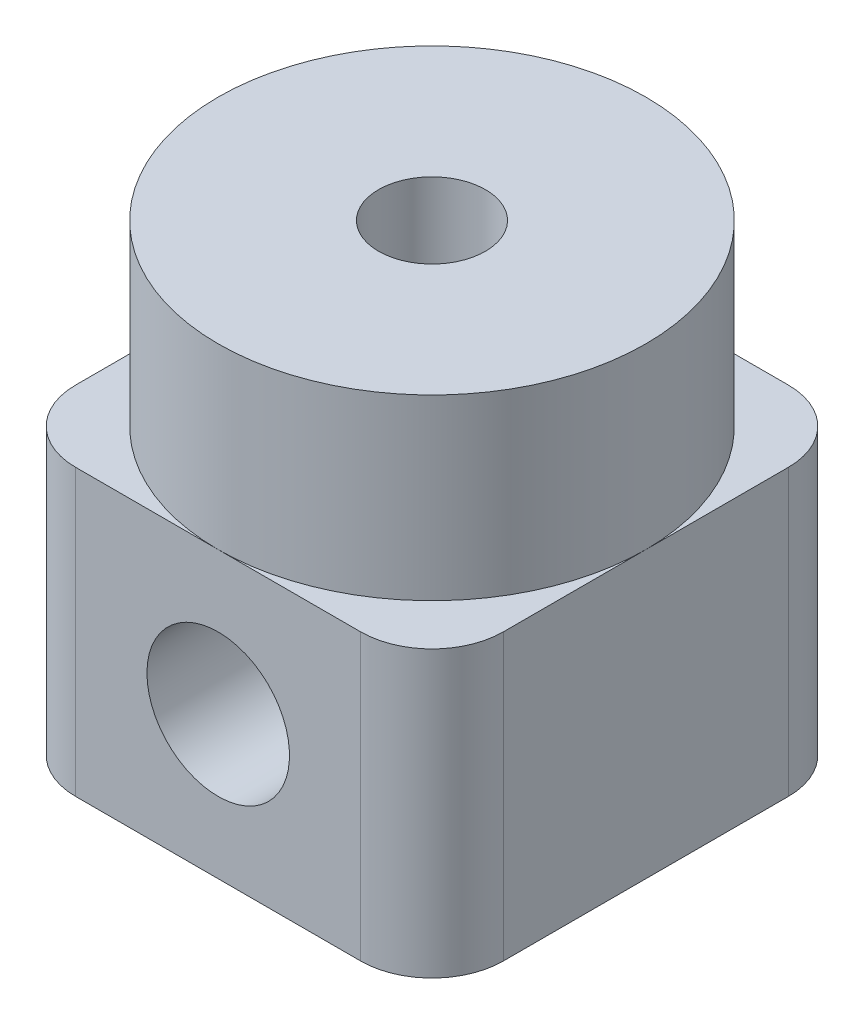
from build123d import *

# Parameters (mm, degrees)
SKETCH_1_R          = 6
EXTRUDE_1_DEPTH     = 5
SKETCH_2_W          = 12
SKETCH_2_H          = 12
EXTRUDE_2_DEPTH     = 8
FILLET_1_R          = 2
SKETCH_3_R          = 1.5
CUT_EXTRUDE_1_DEPTH = 5
SKETCH_4_R          = 2
CUT_EXTRUDE_2_DEPTH = 16.620499352


with BuildPart() as part:
    # 草图1 → 凸台-拉伸1 (new body)
    with BuildSketch(Plane(origin=(0, 0, 0), x_dir=(1, 0, 0), z_dir=(0, 1, 0))):
        with Locations(Location((0, 0, 0), (0, 0, 270))):
            Circle(SKETCH_1_R)
    extrude(amount=EXTRUDE_1_DEPTH)

    # 草图2 → 凸台-拉伸2 (add)
    with BuildSketch(Plane.XZ):
        Rectangle(SKETCH_2_W, SKETCH_2_H)
    extrude(amount=EXTRUDE_2_DEPTH)

    # 圆角1
    fillet_1_edges = [part.edges().sort_by_distance(p)[0] for p in [
        (-6, -4, 6),
        (-6, -4, -6),
        (6, -4, -6),
        (6, -4, 6),
    ]]
    fillet(fillet_1_edges, radius=FILLET_1_R)

    # 草图3 → 切除-拉伸1 (cut)
    with BuildSketch(Plane(origin=(0, 5, 0), x_dir=(1, 0, 0), z_dir=(0, 1, 0))):
        with Locations(Location((0, 0, 0), (0, 0, 270))):
            Circle(SKETCH_3_R)
    extrude(amount=-CUT_EXTRUDE_1_DEPTH, mode=Mode.SUBTRACT)

    # 草图4 → 切除-拉伸2 (cut, through all)
    with BuildSketch(Plane(origin=(0, 0, -6), x_dir=(-1, 0, 0), z_dir=(0, 0, -1))):
        with Locations((0, -4)):
            Circle(SKETCH_4_R)
    extrude(amount=-CUT_EXTRUDE_2_DEPTH, mode=Mode.SUBTRACT)


solid = part.part
